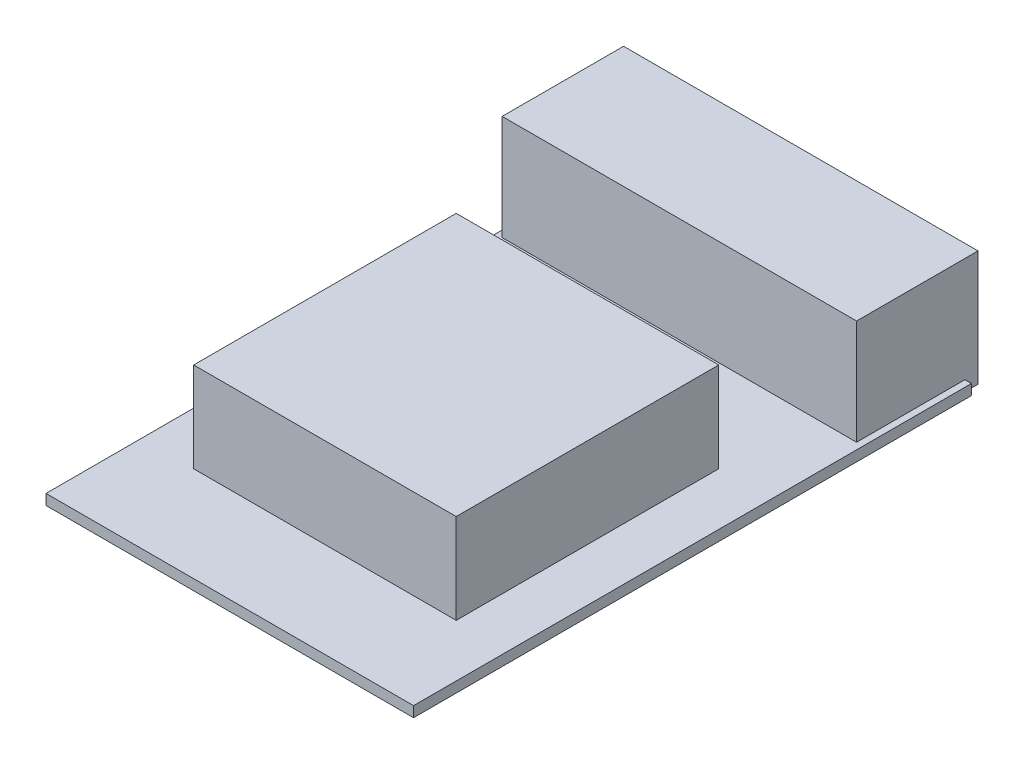
from build123d import *

# Parameters (mm, degrees)
SKETCH1_W           = 56
SKETCH1_H           = 85
BOSS_EXTRUDE1_DEPTH = 1.6
SKETCH2_W           = 54
SKETCH2_H           = 18.5
BOSS_EXTRUDE2_DEPTH = 17.6
SKETCH3_W           = 40
SKETCH3_H           = 40
BOSS_EXTRUDE3_DEPTH = 15.3


with BuildPart() as part:
    # Sketch1 → Boss-Extrude1 (new body)
    with BuildSketch(Plane(origin=(0, 0, 0), x_dir=(1, 0, 0), z_dir=(0, 1, 0))):
        with Locations((-98, 0)):
            Rectangle(SKETCH1_W, SKETCH1_H)
    extrude(amount=BOSS_EXTRUDE1_DEPTH)

    # Sketch2 → Boss-Extrude2 (add)
    with BuildSketch(Plane(origin=(0, 0, 0), x_dir=(1, 0, 0), z_dir=(0, 1, 0))):
        with Locations((-98, 35.25)):
            Rectangle(SKETCH2_W, SKETCH2_H)
    extrude(amount=BOSS_EXTRUDE2_DEPTH)

    # Sketch3 → Boss-Extrude3 (add)
    with BuildSketch(Plane(origin=(0, 0, 0), x_dir=(1, 0, 0), z_dir=(0, 1, 0))):
        with Locations((-98, -8)):
            Rectangle(SKETCH3_W, SKETCH3_H)
    extrude(amount=BOSS_EXTRUDE3_DEPTH)


solid = part.part
